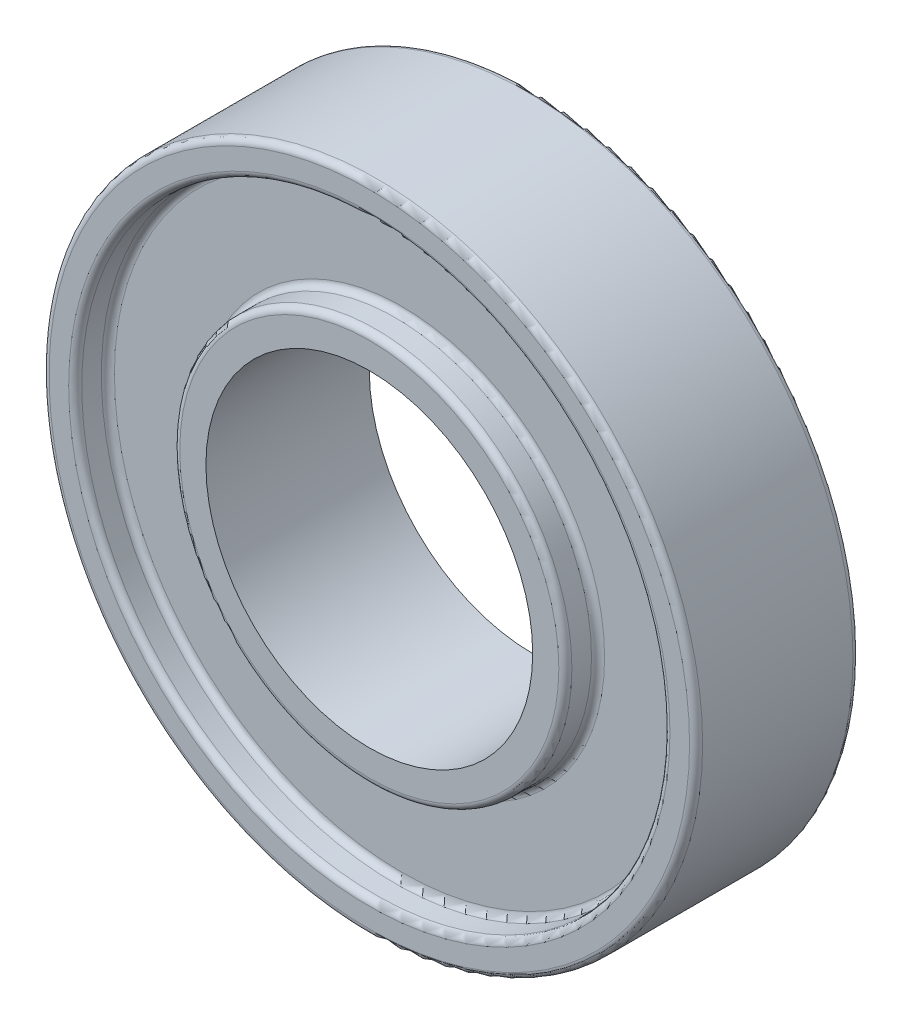
from build123d import *

# Parameters (mm, degrees)
SKETCH_1_R          = 10
SKETCH_1_R_2        = 5
EXTRUDE_1_DEPTH     = 5
SKETCH_3_R          = 9
SKETCH_3_R_2        = 6
CUT_EXTRUDE_1_DEPTH = 1
FILLET_1_R          = 0.2


with BuildPart() as part:
    # 草图1 → 凸台-拉伸1 (new body)
    with BuildSketch(Plane.XY):
        Circle(SKETCH_1_R)
        Circle(SKETCH_1_R_2, mode=Mode.SUBTRACT)
    extrude(amount=EXTRUDE_1_DEPTH)

    # 草图3 → 切除-拉伸1 (cut)
    with BuildSketch(Plane.XY.offset(5)):
        Circle(SKETCH_3_R)
        Circle(SKETCH_3_R_2, mode=Mode.SUBTRACT)
    cut_extrude_1 = extrude(amount=-CUT_EXTRUDE_1_DEPTH, mode=Mode.SUBTRACT)

    # 镜向1: 切除-拉伸1 across plane
    add(cut_extrude_1.mirror(Plane.XY.offset(2.5)), mode=Mode.SUBTRACT)

    # 圆角1
    fillet_1_edges = [part.edges().sort_by_distance(p)[0] for p in [
        (-9, 0, 4),
        (-6, 0, 4),
        (-9, 0, 5),
        (-6, 0, 5),
        (-9, 0, 1),
        (-6, 0, 0),
        (-9, 0, 0),
        (-6, 0, 1),
        (-10, 0, 0),
        (-10, 0, 5),
    ]]
    fillet(fillet_1_edges, radius=FILLET_1_R)


solid = part.part
